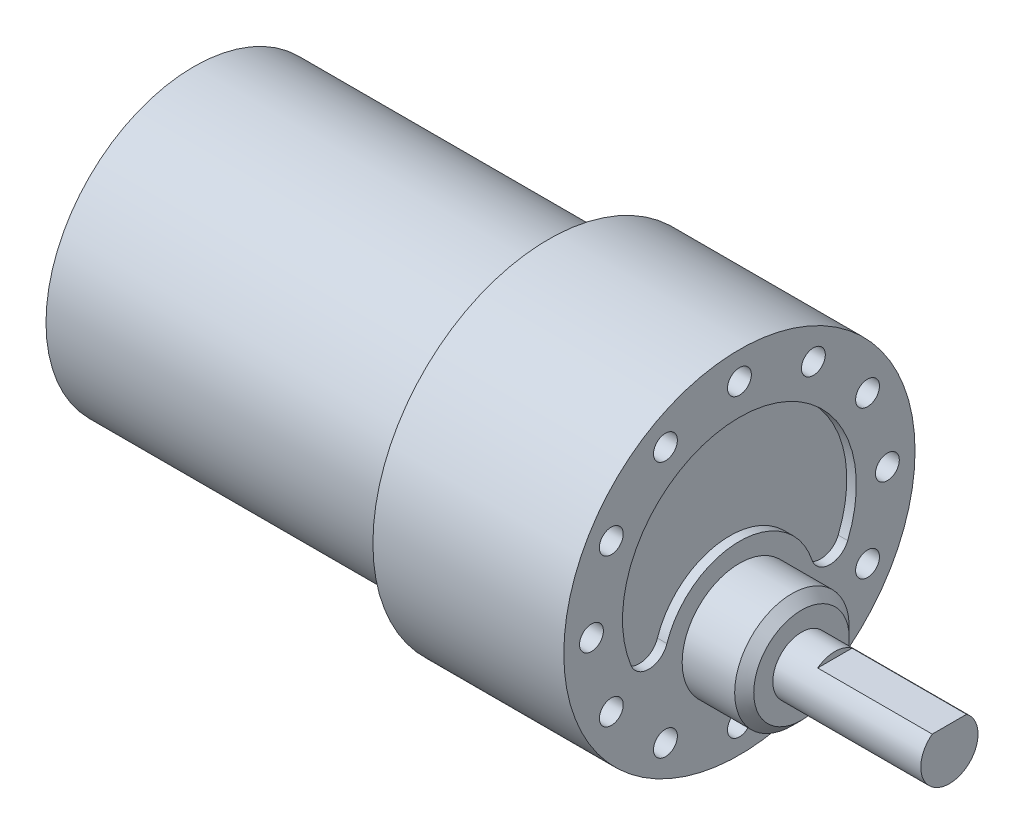
from build123d import *

# Parameters (mm, degrees)
SKETCH1_R                 = 6
SKETCH1_R_2               = 3
BOSS_EXTRUDE1_DEPTH       = 6.5
SKETCH1_3_R               = 3
BOSS_EXTRUDE2_DEPTH       = 22
SKETCH1_4_R               = 18.4
BOSS_EXTRUDE3_DEPTH       = 20
SKETCH1_5_R               = 15.5
BOSS_EXTRUDE4_DEPTH       = 57.15
M3X0_5_TAPPED_HOLE1_D     = 2.5
M3X0_5_TAPPED_HOLE1_DEPTH = 4.675
M3X0_5_TAPPED_HOLE1_TIP   = 0.751075774
CUT_EXTRUDE1_DEPTH        = 1
CUT_EXTRUDE2_START        = -12
CUT_EXTRUDE2_DEPTH        = 12
CHAMFER1_SIZE             = 1


with BuildPart() as part:
    # Sketch1 → Boss-Extrude1 (new body)
    with BuildSketch(Plane(origin=(0, 0, 0), x_dir=(0, 0, -1), z_dir=(1, 0, 0))):
        with Locations((0, -7)):
            Circle(SKETCH1_R)
        with Locations((0, -7)):
            Circle(SKETCH1_R_2, mode=Mode.SUBTRACT)
    extrude(amount=BOSS_EXTRUDE1_DEPTH)

    # Sketch1<3> → Boss-Extrude2 (add)
    with BuildSketch(Plane(origin=(0, 0, 0), x_dir=(0, 0, -1), z_dir=(1, 0, 0))):
        with Locations((0, -7)):
            Circle(SKETCH1_3_R)
    extrude(amount=BOSS_EXTRUDE2_DEPTH)



with BuildPart() as body_2:
    # Sketch1<4> → Boss-Extrude3 (new body)
    with BuildSketch(Plane(origin=(0, 0, 0), x_dir=(0, 0, -1), z_dir=(1, 0, 0))):
        Circle(SKETCH1_4_R)
    extrude(amount=-BOSS_EXTRUDE3_DEPTH)


with BuildPart() as part_1:
    add(part.part)

    add(body_2.part)  # Boss-Extrude4 merges body 2
    # Sketch1<5> → Boss-Extrude4 (add)
    with BuildSketch(Plane(origin=(0, 0, 0), x_dir=(0, 0, -1), z_dir=(1, 0, 0))):
        Circle(SKETCH1_5_R)
    extrude(amount=-BOSS_EXTRUDE4_DEPTH)

    # M3x0.5 Tapped Hole1
    with Locations(Plane(origin=(0, 0, 0), x_dir=(0, 0, -1), z_dir=(1, 0, 0))):
        with Locations((-13.423393759, 7.75), (-15.5, 0), (-13.423393759, -7.75), (-7.75, -13.423393759), (0, -15.5), (7.75, -13.423393759), (13.423393759, -7.75), (15.5, 0), (13.423393759, 7.75), (7.75, 13.423393759), (0, 15.5), (-7.75, 13.423393759)):
            Hole(M3X0_5_TAPPED_HOLE1_D / 2, depth=M3X0_5_TAPPED_HOLE1_DEPTH)
            with Locations((0, 0, -(M3X0_5_TAPPED_HOLE1_DEPTH + M3X0_5_TAPPED_HOLE1_TIP / 2))):  # 118° drill point
                Cone(0, M3X0_5_TAPPED_HOLE1_D / 2, M3X0_5_TAPPED_HOLE1_TIP, mode=Mode.SUBTRACT)

    # Sketch4 → Cut-Extrude1 (cut)
    with BuildSketch(Plane(origin=(0, 0, 0), x_dir=(0, 0, -1), z_dir=(1, 0, 0))):
        with BuildLine():
            ThreePointArc((11.347397534, -4.615091463), (0, 12.25), (-11.347397534, -4.615091463))
            ThreePointArc((-11.347397534, -4.615091463), (-9.427730891, -5.860483562), (-7.595808961, -4.489285714))
            ThreePointArc((-7.595808961, -4.489285714), (0, 1), (7.595808961, -4.489285714))
            ThreePointArc((7.595808961, -4.489285714), (9.427730891, -5.860483562), (11.347397534, -4.615091463))
        make_face()
    extrude(amount=-CUT_EXTRUDE1_DEPTH, mode=Mode.SUBTRACT)

    # Sketch5 → Cut-Extrude2 (cut)
    with BuildSketch(Plane(origin=(22, 0, 0), x_dir=(0, 0, -1), z_dir=(1, 0, 0)).offset(CUT_EXTRUDE2_START)):
        with BuildLine():
            Line((-1.8, -4.6), (1.8, -4.6))
            ThreePointArc((1.8, -4.6), (0, -4), (-1.8, -4.6))
        make_face()
    extrude(amount=CUT_EXTRUDE2_DEPTH, mode=Mode.SUBTRACT)

    # Chamfer1
    chamfer1_edges = [part_1.edges().sort_by_distance(p)[0] for p in [
        (6.5, -7, 6),
    ]]
    chamfer(chamfer1_edges, length=CHAMFER1_SIZE)


solid = part_1.part
